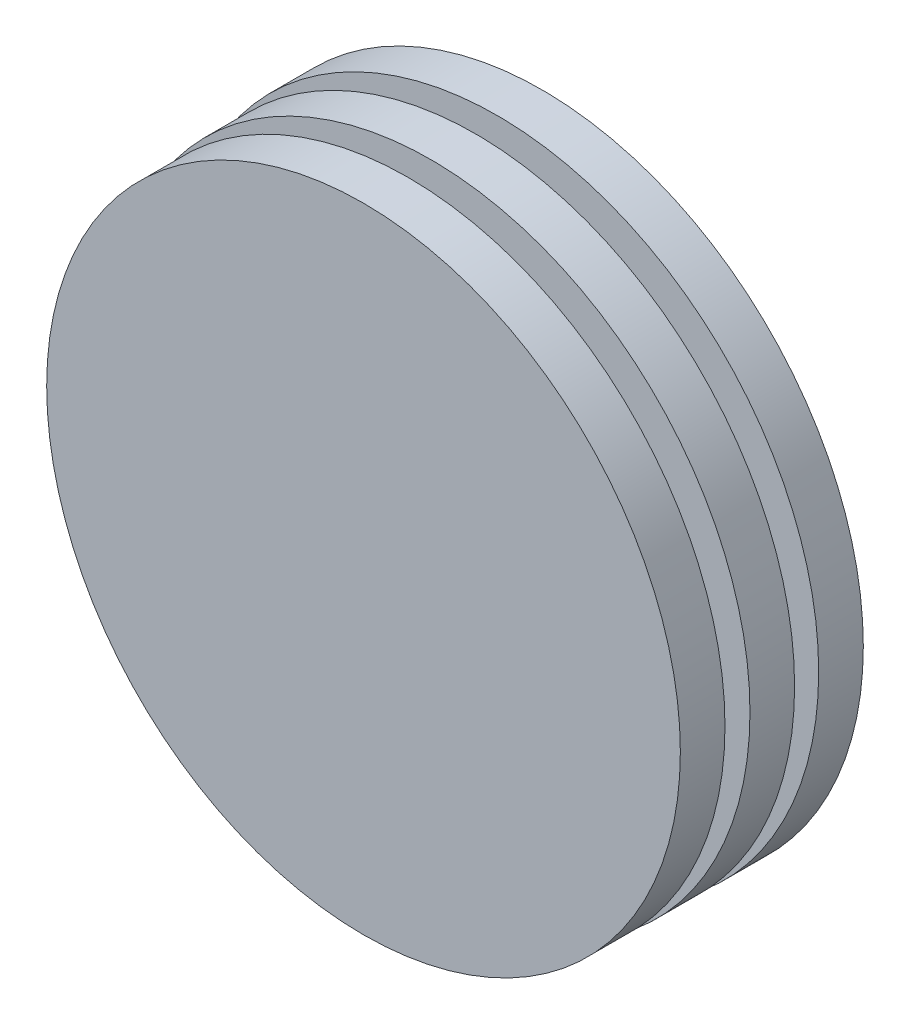
from build123d import *

# Parameters (mm, degrees)
SKETCH_4_R      = 72
EXTRUDE_4_DEPTH = 10
EXTRUDE_START   = 15
SKETCH_4_4_R    = 71.5
EXTRUDE_6_DEPTH = 10
EXTRUDE_START_2 = 30
SKETCH_4_5_R    = 71
EXTRUDE_7_DEPTH = 10


with BuildPart() as part:
    # 草圖4 → 填料-伸長4 (new body)
    with BuildSketch(Plane.XY):
        with Locations((0, 4.720385608)):
            Circle(SKETCH_4_R)
    extrude(amount=EXTRUDE_4_DEPTH)


with BuildPart() as body_2:
    # 草圖4<4> → 填料-伸長6 (new body)
    with BuildSketch(Plane.XY.offset(EXTRUDE_START)):
        with Locations((0.100658917, 4.230622622)):
            Circle(SKETCH_4_4_R)
    extrude(amount=EXTRUDE_6_DEPTH)


with BuildPart() as body_3:
    # 草圖4<5> → 填料-伸長7 (new body)
    with BuildSketch(Plane.XY.offset(EXTRUDE_START_2)):
        with Locations((0, 3.720385608)):
            Circle(SKETCH_4_5_R)
    extrude(amount=EXTRUDE_7_DEPTH)


solid = Compound([part.part, body_2.part, body_3.part])
